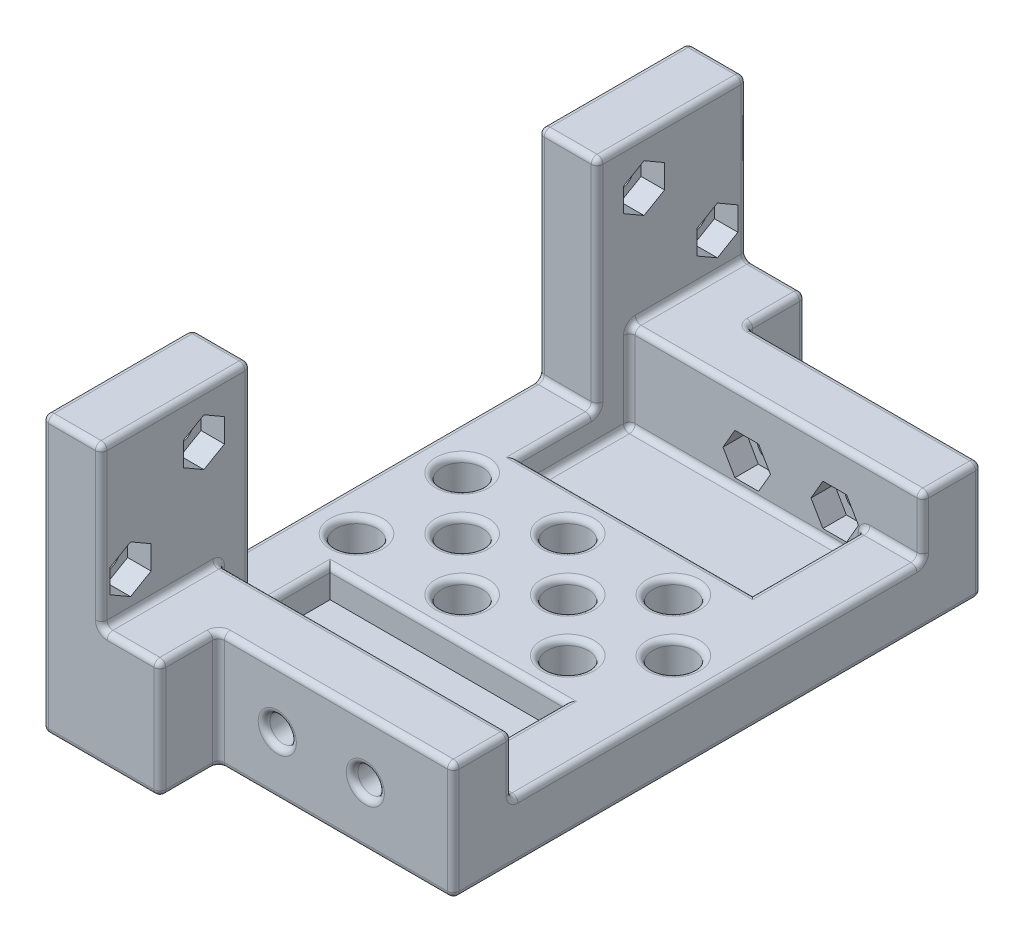
from build123d import *

# Parameters (mm, degrees)
SKETCH1_R           = 2.25
BOSS_EXTRUDE1_DEPTH = 10
BOSS_EXTRUDE2_DEPTH = 50
SKETCH8_W           = 10
SKETCH8_H           = 20
BOSS_EXTRUDE3_DEPTH = 10
SKETCH9_R           = 2.25
CUT_EXTRUDE4_DEPTH  = 110
CUT_EXTRUDE5_DEPTH  = 4
CUT_EXTRUDE6_DEPTH  = 4
CUT_EXTRUDE7_DEPTH  = 4
BOSS_EXTRUDE4_DEPTH = 5
SKETCH14_R          = 3.5
CUT_EXTRUDE8_DEPTH  = 10
FILLET5_R           = 1


with BuildPart() as part:
    # Sketch1 → Boss-Extrude1 (new body)
    with BuildSketch(Plane(origin=(0, 0, 0), x_dir=(0, 0, -1), z_dir=(1, 0, 0))):
        Polygon((-38.693472114, 11.344926417), (-13.193472114, 11.344926417), (-13.193472114, -25.655073583), (45.806527886, -25.655073583), (45.806527886, 11.344926417), (71.306527886, 11.344926417), (71.306527886, -35.655073583), (-38.693472114, -35.655073583), align=None)
        with Locations((-33.693472114, -9.155073583)):
            Circle(SKETCH1_R, mode=Mode.SUBTRACT)
        with Locations((-21.193472114, 3.344926417)):
            Circle(SKETCH1_R, mode=Mode.SUBTRACT)
        with Locations((66.306527886, -9.155073583)):
            Circle(SKETCH1_R, mode=Mode.SUBTRACT)
        with Locations((53.806527886, 3.344926417)):
            Circle(SKETCH1_R, mode=Mode.SUBTRACT)
    extrude(amount=BOSS_EXTRUDE1_DEPTH)

    # Sketch2 → Boss-Extrude2 (add)
    with BuildSketch(Plane(origin=(10, 0, 0), x_dir=(0, 0, -1), z_dir=(1, 0, 0))):
        Polygon((-28.693472114, -35.655073583), (61.306527886, -35.655073583), (61.306527886, -15.655073583), (51.306527886, -15.655073583), (51.306527886, -30.655073583), (-18.693472114, -30.655073583), (-18.693472114, -15.655073583), (-28.693472114, -15.655073583), align=None)
    extrude(amount=BOSS_EXTRUDE2_DEPTH)

    # Sketch8 → Boss-Extrude3 (add)
    with BuildSketch(Plane(origin=(10, 0, 0), x_dir=(0, 0, -1), z_dir=(1, 0, 0))):
        with Locations((-33.693472114, -25.655073583)):
            Rectangle(SKETCH8_W, SKETCH8_H)
        with Locations((66.306527886, -25.655073583)):
            Rectangle(SKETCH8_W, SKETCH8_H)
    extrude(amount=BOSS_EXTRUDE3_DEPTH)

    # Sketch9 → Cut-Extrude4 (cut)
    with BuildSketch(Plane.XY.offset(28.693472114)):
        with Locations((30, -25.655073583)):
            Circle(SKETCH9_R)
        with Locations((45, -25.655073583)):
            Circle(SKETCH9_R)
    extrude(amount=-CUT_EXTRUDE4_DEPTH, mode=Mode.SUBTRACT)

    # Sketch10 → Cut-Extrude5 (cut)
    with BuildSketch(Plane(origin=(10, 0, 0), x_dir=(0, 0, -1), z_dir=(1, 0, 0))):
        Polygon((-33.693472114, -5.113621699), (-37.193472114, -7.134347641), (-37.193472114, -11.175799525), (-33.693472114, -13.196525468), (-30.193472114, -11.175799525), (-30.193472114, -7.134347641), align=None)
        Polygon((-21.193472114, 7.386378301), (-24.693472114, 5.365652359), (-24.693472114, 1.324200475), (-21.193472114, -0.696525468), (-17.693472114, 1.324200475), (-17.693472114, 5.365652359), align=None)
        Polygon((53.806527886, 7.386378301), (50.306527886, 5.365652359), (50.306527886, 1.324200475), (53.806527886, -0.696525468), (57.306527886, 1.324200475), (57.306527886, 5.365652359), align=None)
        Polygon((66.306527886, -5.113621699), (62.806527886, -7.134347641), (62.806527886, -11.175799525), (66.306527886, -13.196525468), (69.806527886, -11.175799525), (69.806527886, -7.134347641), align=None)
    extrude(amount=-CUT_EXTRUDE5_DEPTH, mode=Mode.SUBTRACT)

    # Sketch11 → Cut-Extrude6 (cut)
    with BuildSketch(Plane.XY.offset(-51.306527886)):
        Polygon((49.041451884, -25.655073583), (47.020725942, -22.155073583), (42.979274058, -22.155073583), (40.958548116, -25.655073583), (42.979274058, -29.155073583), (47.020725942, -29.155073583), align=None)
        Polygon((34.041451884, -25.655073583), (32.020725942, -22.155073583), (27.979274058, -22.155073583), (25.958548116, -25.655073583), (27.979274058, -29.155073583), (32.020725942, -29.155073583), align=None)
    extrude(amount=-CUT_EXTRUDE6_DEPTH, mode=Mode.SUBTRACT)

    # Sketch12 → Cut-Extrude7 (cut)
    with BuildSketch(Plane(origin=(0, 0, 18.693472114), x_dir=(-1, 0, 0), z_dir=(0, 0, -1))):
        Polygon((-40.958548116, -25.655073583), (-42.979274058, -22.155073583), (-47.020725942, -22.155073583), (-49.041451884, -25.655073583), (-47.020725942, -29.155073583), (-42.979274058, -29.155073583), align=None)
        Polygon((-25.958548116, -25.655073583), (-27.979274058, -22.155073583), (-32.020725942, -22.155073583), (-34.041451884, -25.655073583), (-32.020725942, -29.155073583), (-27.979274058, -29.155073583), align=None)
    extrude(amount=-CUT_EXTRUDE7_DEPTH, mode=Mode.SUBTRACT)

    # Sketch13 → Boss-Extrude4 (add)
    with BuildSketch(Plane(origin=(0, -30.655073583, 0), x_dir=(1, 0, 0), z_dir=(0, 1, 0))):
        Polygon((60, 51.306527886), (50, 51.306527886), (50, 32.306527886), (10, 32.306527886), (10, 0.306527886), (50, 0.306527886), (50, -18.693472114), (60, -18.693472114), align=None)
    extrude(amount=BOSS_EXTRUDE4_DEPTH)

    # Sketch14 → Cut-Extrude8 (cut)
    with BuildSketch(Plane(origin=(0, -25.655073583, 0), x_dir=(1, 0, 0), z_dir=(0, 1, 0))):
        with Locations(Location((7.5, 25.306527886, 0), (0, 0, 270))):
            Circle(SKETCH14_R)
        with Locations(Location((7.5, 7.306527886, 0), (0, 0, 270))):
            Circle(SKETCH14_R)
        with Locations(Location((43.5, 25.306527886, 0), (0, 0, 270))):
            Circle(SKETCH14_R)
        with Locations(Location((43.5, 7.306527886, 0), (0, 0, 270))):
            Circle(SKETCH14_R)
        with Locations(Location((25.5, 25.306527886, 0), (0, 0, 270))):
            Circle(SKETCH14_R)
        with Locations(Location((25.5, 7.306527886, 0), (0, 0, 270))):
            Circle(SKETCH14_R)
        with Locations(Location((16.5, 16.306527886, 0), (0, 0, 270))):
            Circle(SKETCH14_R)
        with Locations(Location((34.5, 16.306527886, 0), (0, 0, 270))):
            Circle(SKETCH14_R)
        with Locations(Location((52.5, 16.306527886, 0), (0, 0, 270))):
            Circle(SKETCH14_R)
    extrude(amount=-CUT_EXTRUDE8_DEPTH, mode=Mode.SUBTRACT)

    # Fillet5
    fillet5_edges = [part.edges().sort_by_distance(p)[0] for p in [
        (27.75, -25.655073583, 28.693472114),
        (0, 11.344926417, -58.556527886),
        (42.75, -25.655073583, -61.306527886),
        (42.75, -25.655073583, 28.693472114),
        (0, -12.155073583, -71.306527886),
        (0, -35.655073583, -16.306527886),
        (0, -12.155073583, 38.693472114),
        (5, 11.344926417, 38.693472114),
        (5, 11.344926417, 13.193472114),
        (5, -25.655073583, 13.193472114),
        (5, -25.655073583, -45.806527886),
        (5, 11.344926417, -45.806527886),
        (5, 11.344926417, -71.306527886),
        (10, -35.655073583, -71.306527886),
        (10, -35.655073583, 38.693472114),
        (10, 11.344926417, -58.556527886),
        (10, -7.155073583, -45.806527886),
        (0, -9.155073583, 35.943472114),
        (10, -25.655073583, -39.056527886),
        (0, 3.344926417, 23.443472114),
        (60, -20.655073583, 18.693472114),
        (30, -30.655073583, 18.693472114),
        (30, -30.655073583, -51.306527886),
        (10, -25.655073583, 6.443472114),
        (50, -28.155073583, -51.306527886),
        (10, -7.155073583, 13.193472114),
        (50, -28.155073583, 18.693472114),
        (60, -25.655073583, -16.306527886),
        (55, -25.655073583, -51.306527886),
        (50, -25.655073583, -41.806527886),
        (30, -25.655073583, -32.306527886),
        (0, -9.155073583, -64.056527886),
        (30, -25.655073583, -0.306527886),
        (50, -25.655073583, 9.193472114),
        (55, -25.655073583, 18.693472114),
        (25.5, -35.655073583, -28.806527886),
        (25.5, -25.655073583, -28.806527886),
        (43.5, -35.655073583, -10.806527886),
        (43.5, -25.655073583, -10.806527886),
        (43.5, -35.655073583, -28.806527886),
        (43.5, -25.655073583, -28.806527886),
        (10, 11.344926417, 25.943472114),
        (0, 3.344926417, -51.556527886),
        (7.5, -35.655073583, -10.806527886),
        (7.5, -25.655073583, -10.806527886),
        (25.5, -35.655073583, -10.806527886),
        (25.5, -25.655073583, -10.806527886),
        (16.5, -35.655073583, -19.806527886),
        (16.5, -25.655073583, -19.806527886),
        (34.5, -35.655073583, -19.806527886),
        (34.5, -25.655073583, -19.806527886),
        (52.5, -35.655073583, -19.806527886),
        (52.5, -25.655073583, -19.806527886),
        (7.5, -35.655073583, -28.806527886),
        (7.5, -25.655073583, -28.806527886),
        (40, -15.655073583, 28.693472114),
        (40, -35.655073583, 28.693472114),
        (40, -35.655073583, -61.306527886),
        (10, -15.655073583, -61.306527886),
        (40, -15.655073583, -61.306527886),
        (10, -23.155073583, -51.306527886),
        (35, -15.655073583, -51.306527886),
        (10, -30.655073583, -41.806527886),
        (10, -23.155073583, 18.693472114),
        (10, -15.655073583, 28.693472114),
        (35, -15.655073583, 18.693472114),
        (60, -25.655073583, 28.693472114),
        (60, -35.655073583, -16.306527886),
        (10, -2.155073583, 38.693472114),
        (60, -25.655073583, -61.306527886),
        (60, -15.655073583, -56.306527886),
        (60, -20.655073583, -51.306527886),
        (60, -15.655073583, 23.693472114),
        (15, -15.655073583, 38.693472114),
        (20, -25.655073583, 28.693472114),
        (20, -15.655073583, 33.693472114),
        (20, -25.655073583, 38.693472114),
        (20, -35.655073583, 33.693472114),
        (10, -2.155073583, -71.306527886),
        (15, -15.655073583, -71.306527886),
        (20, -25.655073583, -61.306527886),
        (20, -35.655073583, -66.306527886),
        (20, -25.655073583, -71.306527886),
        (20, -15.655073583, -66.306527886),
        (0, 11.344926417, 25.943472114),
        (0, -7.155073583, 13.193472114),
        (0, -25.655073583, -16.306527886),
        (0, -7.155073583, -45.806527886),
        (27.75, -25.655073583, -61.306527886),
    ]]
    fillet(fillet5_edges, radius=FILLET5_R)


solid = part.part
